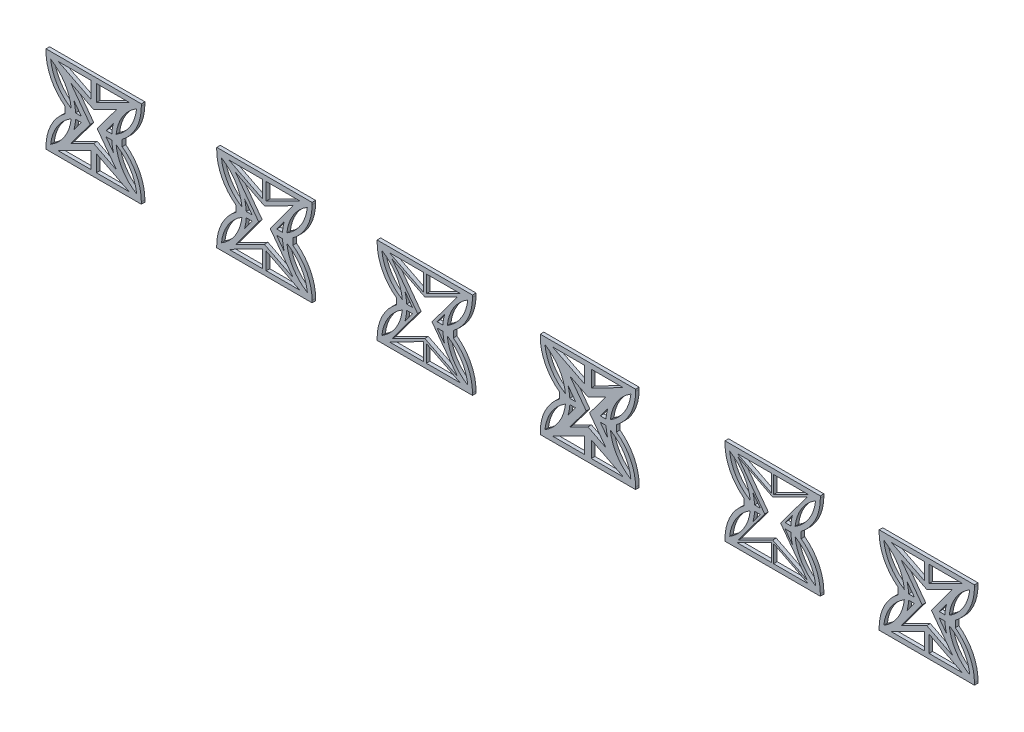
from build123d import *

# Parameters (mm, degrees)
BOSS_EXTRUDE1_DEPTH   = 1.2
BOSS_EXTRUDE1_2_DEPTH = 1.2
BOSS_EXTRUDE1_3_DEPTH = 1.2
BOSS_EXTRUDE1_4_DEPTH = 1.2
BOSS_EXTRUDE1_5_DEPTH = 1.2
BOSS_EXTRUDE1_6_DEPTH = 1.2


with BuildPart() as part:
    # Sketch1 → Boss-Extrude1 (new body)
    with BuildSketch(Plane.XY):
        with BuildLine():
            Line((-10.302018004, 3.271108001), (-10.302018004, 1.110990221))
            ThreePointArc((-10.302018004, 1.110990221), (-15.057769334, -4.572954896), (-16.763496129, -11.785090426))
            Line((-16.763496129, -11.785090426), (-16.763496129, -12.501542078))
            Line((-16.763496129, -12.501542078), (15.436503871, -12.501542078))
            Line((15.436503871, -12.501542078), (15.436503871, -11.785090426))
            ThreePointArc((15.436503871, -11.785090426), (13.730777076, -4.572954896), (8.975025747, 1.110990221))
            Line((8.975025747, 1.110990221), (8.975025747, 3.271108001))
            ThreePointArc((8.975025747, 3.271108001), (13.730777076, 8.955053118), (15.436503871, 16.167188648))
            Line((15.436503871, 16.167188648), (15.436503871, 16.883640301))
            Line((15.436503871, 16.883640301), (-16.763496129, 16.883640301))
            Line((-16.763496129, 16.883640301), (-16.763496129, 16.167188648))
            ThreePointArc((-16.763496129, 16.167188648), (-15.057769334, 8.955053118), (-10.302018004, 3.271108001))
        make_face()
        Polygon((-8.409623915, 11.04926607), (-1.851704299, 2.191049111), (-8.409623915, -6.667167848), (-0.663496129, -2.754877962), (7.082631657, -6.667167848), (0.524712041, 2.191049111), (7.082631657, 11.04926607), (-0.663496129, 7.136976185), align=None, mode=Mode.SUBTRACT)
        Polygon((-1.586935905, -10.866558404), (-12.627539219, -10.866558404), (-1.586935905, -5.290347699), (-1.586935905, -10.705031536), align=None, mode=Mode.SUBTRACT)
        with BuildLine():
            Line((-4.829630218, 3.109581133), (-6.778538045, 3.109581133))
            ThreePointArc((-6.778538045, 3.109581133), (-6.96992636, 4.823270811), (-7.344408998, 6.506459616))
            Line((-7.344408998, 6.506459616), (-4.829630218, 3.109581133))
        make_face(mode=Mode.SUBTRACT)
        Polygon((0.259943647, 15.087129758), (0.259943647, 15.248656627), (11.300546962, 15.248656627), (0.259943647, 9.672445922), align=None, mode=Mode.SUBTRACT)
        with BuildLine():
            Line((3.50263796, 3.109581133), (5.451545787, 3.109581133))
            ThreePointArc((5.451545787, 3.109581133), (5.642934102, 4.823270811), (6.01741674, 6.506459616))
            Line((6.01741674, 6.506459616), (3.50263796, 3.109581133))
        make_face(mode=Mode.SUBTRACT)
        Polygon((-1.586935905, 15.248656627), (-12.627539219, 15.248656627), (-1.586935905, 9.672445922), (-1.586935905, 15.087129758), align=None, mode=Mode.SUBTRACT)
        Polygon((0.259943647, -5.290347699), (0.259943647, -10.866558404), (11.300546962, -10.866558404), align=None, mode=Mode.SUBTRACT)
        with BuildLine():
            Line((-4.829630218, 1.27251709), (-6.778538045, 1.27251709))
            ThreePointArc((-6.778538045, 1.27251709), (-6.96992636, -0.441172588), (-7.344408998, -2.124361394))
            Line((-7.344408998, -2.124361394), (-4.829630218, 1.27251709))
        make_face(mode=Mode.SUBTRACT)
        with BuildLine():
            Line((3.50263796, 1.27251709), (5.451545787, 1.27251709))
            ThreePointArc((5.451545787, 1.27251709), (5.642934102, -0.441172588), (6.01741674, -2.124361394))
            Line((6.01741674, -2.124361394), (3.50263796, 1.27251709))
        make_face(mode=Mode.SUBTRACT)
        with BuildLine():
            ThreePointArc((13.849027666, 14.650245783), (9.110337743, 9.988254603), (6.931428547, 3.707991976))
            ThreePointArc((6.931428547, 3.707991976), (11.67011847, 8.369983156), (13.849027666, 14.650245783))
        make_face(mode=Mode.SUBTRACT)
        with BuildLine():
            ThreePointArc((-8.258420804, 3.707991976), (-12.997110727, 8.369983156), (-15.176019924, 14.650245783))
            ThreePointArc((-15.176019924, 14.650245783), (-10.43733, 9.988254603), (-8.258420804, 3.707991976))
        make_face(mode=Mode.SUBTRACT)
        with BuildLine():
            ThreePointArc((13.849027666, -10.268147561), (9.110337743, -5.606156381), (6.931428547, 0.674106247))
            ThreePointArc((6.931428547, 0.674106247), (11.67011847, -3.987884934), (13.849027666, -10.268147561))
        make_face(mode=Mode.SUBTRACT)
        with BuildLine():
            ThreePointArc((-8.258420804, 0.674106247), (-12.997110727, -3.987884934), (-15.176019924, -10.268147561))
            ThreePointArc((-15.176019924, -10.268147561), (-10.43733, -5.606156381), (-8.258420804, 0.674106247))
        make_face(mode=Mode.SUBTRACT)
    extrude(amount=BOSS_EXTRUDE1_DEPTH)


with BuildPart() as body_2:
    # Sketch1 → Boss-Extrude1 2 (new body)
    with BuildSketch(Plane.XY):
        with BuildLine():
            Line((40.905511172, -12.501542078), (73.105511172, -12.501542078))
            Line((73.105511172, -12.501542078), (73.105511172, -11.785090426))
            ThreePointArc((73.105511172, -11.785090426), (71.399784377, -4.572954896), (66.644033048, 1.110990221))
            Line((66.644033048, 1.110990221), (66.644033048, 3.271108001))
            ThreePointArc((66.644033048, 3.271108001), (71.399784377, 8.955053118), (73.105511172, 16.167188648))
            Line((73.105511172, 16.167188648), (73.105511172, 16.883640301))
            Line((73.105511172, 16.883640301), (40.905511172, 16.883640301))
            Line((40.905511172, 16.883640301), (40.905511172, 16.167188648))
            ThreePointArc((40.905511172, 16.167188648), (42.611237968, 8.955053118), (47.366989297, 3.271108001))
            Line((47.366989297, 3.271108001), (47.366989297, 1.110990221))
            ThreePointArc((47.366989297, 1.110990221), (42.611237968, -4.572954896), (40.905511172, -11.785090426))
            Line((40.905511172, -11.785090426), (40.905511172, -12.501542078))
        make_face()
        Polygon((56.382071397, 15.248656627), (45.041468082, 15.248656627), (56.382071397, 9.520926737), align=None, mode=Mode.SUBTRACT)
        with BuildLine():
            Line((52.839377084, 1.27251709), (50.324598303, -2.124361394))
            ThreePointArc((50.324598303, -2.124361394), (50.699080942, -0.441172588), (50.890469257, 1.27251709))
            Line((50.890469257, 1.27251709), (52.839377084, 1.27251709))
        make_face(mode=Mode.SUBTRACT)
        with BuildLine():
            Line((52.839377084, 3.109581133), (50.890469257, 3.109581133))
            ThreePointArc((50.890469257, 3.109581133), (50.699080942, 4.823270811), (50.324598303, 6.506459616))
            Line((50.324598303, 6.506459616), (52.839377084, 3.109581133))
        make_face(mode=Mode.SUBTRACT)
        with BuildLine():
            Line((61.171645261, 3.109581133), (63.686424042, 6.506459616))
            ThreePointArc((63.686424042, 6.506459616), (63.311941403, 4.823270811), (63.120553088, 3.109581133))
            Line((63.120553088, 3.109581133), (61.171645261, 3.109581133))
        make_face(mode=Mode.SUBTRACT)
        with BuildLine():
            Line((61.171645261, 1.27251709), (63.120553088, 1.27251709))
            ThreePointArc((63.120553088, 1.27251709), (63.311941403, -0.441172588), (63.686424042, -2.124361394))
            Line((63.686424042, -2.124361394), (61.171645261, 1.27251709))
        make_face(mode=Mode.SUBTRACT)
        Polygon((57.628950948, 9.520926737), (68.969554263, 15.248656627), (57.628950948, 15.248656627), align=None, mode=Mode.SUBTRACT)
        Polygon((66.738829847, 12.725109234), (58.940249181, 2.191049111), (66.738829847, -8.343011012), (57.005511172, -3.427062649), (47.272192498, -8.343011012), (55.070773164, 2.191049111), (47.272192498, 12.725109234), (57.005511172, 7.809160871), align=None, mode=Mode.SUBTRACT)
        Polygon((68.969554263, -10.866558404), (57.628950948, -10.866558404), (57.628950948, -5.138828515), align=None, mode=Mode.SUBTRACT)
        Polygon((56.382071397, -10.866558404), (56.382071397, -5.138828515), (45.041468082, -10.866558404), align=None, mode=Mode.SUBTRACT)
        with BuildLine():
            ThreePointArc((42.492987378, 14.650245783), (47.231677301, 9.988254603), (49.410586497, 3.707991976))
            ThreePointArc((49.410586497, 3.707991976), (44.671896574, 8.369983156), (42.492987378, 14.650245783))
        make_face(mode=Mode.SUBTRACT)
        with BuildLine():
            ThreePointArc((49.410586497, 0.674106247), (44.671896574, -3.987884934), (42.492987378, -10.268147561))
            ThreePointArc((42.492987378, -10.268147561), (47.231677301, -5.606156381), (49.410586497, 0.674106247))
        make_face(mode=Mode.SUBTRACT)
        with BuildLine():
            ThreePointArc((64.600435848, 0.674106247), (69.339125771, -3.987884934), (71.518034967, -10.268147561))
            ThreePointArc((71.518034967, -10.268147561), (66.779345044, -5.606156381), (64.600435848, 0.674106247))
        make_face(mode=Mode.SUBTRACT)
        with BuildLine():
            ThreePointArc((71.518034967, 14.650245783), (66.779345044, 9.988254603), (64.600435848, 3.707991976))
            ThreePointArc((64.600435848, 3.707991976), (69.339125771, 8.369983156), (71.518034967, 14.650245783))
        make_face(mode=Mode.SUBTRACT)
    extrude(amount=BOSS_EXTRUDE1_2_DEPTH)


with BuildPart() as body_3:
    # Sketch1 → Boss-Extrude1 3 (new body)
    with BuildSketch(Plane.XY):
        with BuildLine():
            Line((95.090603796, -11.785090426), (95.090603796, -12.501542078))
            Line((95.090603796, -12.501542078), (127.290603796, -12.501542078))
            Line((127.290603796, -12.501542078), (127.290603796, -11.785090426))
            ThreePointArc((127.290603796, -11.785090426), (125.584877001, -4.572954896), (120.829125672, 1.110990221))
            Line((120.829125672, 1.110990221), (120.829125672, 3.271108001))
            ThreePointArc((120.829125672, 3.271108001), (125.584877001, 8.955053118), (127.290603796, 16.167188648))
            Line((127.290603796, 16.167188648), (127.290603796, 16.883640301))
            Line((127.290603796, 16.883640301), (95.090603796, 16.883640301))
            Line((95.090603796, 16.883640301), (95.090603796, 16.167188648))
            ThreePointArc((95.090603796, 16.167188648), (96.796330592, 8.955053118), (101.552081921, 3.271108001))
            Line((101.552081921, 3.271108001), (101.552081921, 1.110990221))
            ThreePointArc((101.552081921, 1.110990221), (96.796330592, -4.572954896), (95.090603796, -11.785090426))
        make_face()
        Polygon((111.690603792, 9.458581754), (123.154646887, 15.248656627), (111.690603792, 15.248656627), align=None, mode=Mode.SUBTRACT)
        with BuildLine():
            Line((115.356737885, 3.109581133), (117.305645712, 3.109581133))
            ThreePointArc((117.305645712, 3.109581133), (117.497034027, 4.823270811), (117.871516666, 6.506459616))
            Line((117.871516666, 6.506459616), (115.356737885, 3.109581133))
        make_face(mode=Mode.SUBTRACT)
        Polygon((110.690603801, 9.458581754), (99.226560706, 15.248656627), (110.690603801, 15.248656627), align=None, mode=Mode.SUBTRACT)
        with BuildLine():
            Line((107.024469708, 1.27251709), (104.509690927, -2.124361394))
            ThreePointArc((104.509690927, -2.124361394), (104.884173566, -0.441172588), (105.075561881, 1.27251709))
            Line((105.075561881, 1.27251709), (107.024469708, 1.27251709))
        make_face(mode=Mode.SUBTRACT)
        with BuildLine():
            Line((115.356737885, 1.27251709), (117.305645712, 1.27251709))
            ThreePointArc((117.305645712, 1.27251709), (117.497034027, -0.441172588), (117.871516666, -2.124361394))
            Line((117.871516666, -2.124361394), (115.356737885, 1.27251709))
        make_face(mode=Mode.SUBTRACT)
        with BuildLine():
            Line((107.024469708, 3.109581133), (104.509690927, 6.506459616))
            ThreePointArc((104.509690927, 6.506459616), (104.884173566, 4.823270811), (105.075561881, 3.109581133))
            Line((105.075561881, 3.109581133), (107.024469708, 3.109581133))
        make_face(mode=Mode.SUBTRACT)
        Polygon((122.248716397, 13.84233801), (113.623028364, 2.191049111), (122.248716397, -9.460239788), (111.190603796, -3.875185774), (100.132491196, -9.460239788), (108.758179229, 2.191049111), (100.132491196, 13.84233801), (111.190603796, 8.257283996), align=None, mode=Mode.SUBTRACT)
        Polygon((111.690603792, -5.076483532), (123.154646887, -10.866558404), (111.690603792, -10.866558404), align=None, mode=Mode.SUBTRACT)
        Polygon((110.690603801, -10.866558404), (110.690603801, -5.076483532), (99.226560706, -10.866558404), align=None, mode=Mode.SUBTRACT)
        with BuildLine():
            ThreePointArc((125.703127591, 14.650245783), (120.964437668, 9.988254603), (118.785528472, 3.707991976))
            ThreePointArc((118.785528472, 3.707991976), (123.524218395, 8.369983156), (125.703127591, 14.650245783))
        make_face(mode=Mode.SUBTRACT)
        with BuildLine():
            ThreePointArc((118.785528472, 0.674106247), (123.524218395, -3.987884934), (125.703127591, -10.268147561))
            ThreePointArc((125.703127591, -10.268147561), (120.964437668, -5.606156381), (118.785528472, 0.674106247))
        make_face(mode=Mode.SUBTRACT)
        with BuildLine():
            ThreePointArc((96.678080002, 14.650245783), (101.416769925, 9.988254603), (103.595679121, 3.707991976))
            ThreePointArc((103.595679121, 3.707991976), (98.856989198, 8.369983156), (96.678080002, 14.650245783))
        make_face(mode=Mode.SUBTRACT)
        with BuildLine():
            ThreePointArc((103.595679121, 0.674106247), (98.856989198, -3.987884934), (96.678080002, -10.268147561))
            ThreePointArc((96.678080002, -10.268147561), (101.416769925, -5.606156381), (103.595679121, 0.674106247))
        make_face(mode=Mode.SUBTRACT)
    extrude(amount=BOSS_EXTRUDE1_3_DEPTH)


with BuildPart() as body_4:
    # Sketch1 → Boss-Extrude1 4 (new body)
    with BuildSketch(Plane.XY):
        with BuildLine():
            Line((212.590717444, 16.167188648), (212.590717444, 16.883640301))
            Line((212.590717444, 16.883640301), (244.790717444, 16.883640301))
            Line((244.790717444, 16.883640301), (244.790717444, 16.167188648))
            ThreePointArc((244.790717444, 16.167188648), (243.084990649, 8.955053118), (238.32923932, 3.271108001))
            Line((238.32923932, 3.271108001), (238.32923932, 1.110990221))
            ThreePointArc((238.32923932, 1.110990221), (243.084990649, -4.572954896), (244.790717444, -11.785090426))
            Line((244.790717444, -11.785090426), (244.790717444, -12.501542078))
            Line((244.790717444, -12.501542078), (212.590717444, -12.501542078))
            Line((212.590717444, -12.501542078), (212.590717444, -11.785090426))
            ThreePointArc((212.590717444, -11.785090426), (214.296444239, -4.572954896), (219.052195569, 1.110990221))
            Line((219.052195569, 1.110990221), (219.052195569, 3.271108001))
            ThreePointArc((219.052195569, 3.271108001), (214.296444239, 8.955053118), (212.590717444, 16.167188648))
        make_face()
        with BuildLine():
            Line((232.856851533, 1.27251709), (234.80575936, 1.27251709))
            ThreePointArc((234.80575936, 1.27251709), (234.997147675, -0.441172588), (235.371630313, -2.124361394))
            Line((235.371630313, -2.124361394), (232.856851533, 1.27251709))
        make_face(mode=Mode.SUBTRACT)
        with BuildLine():
            Line((224.524583355, 1.27251709), (222.575675528, 1.27251709))
            ThreePointArc((222.575675528, 1.27251709), (222.384287213, -0.441172588), (222.009804575, -2.124361394))
            Line((222.009804575, -2.124361394), (224.524583355, 1.27251709))
        make_face(mode=Mode.SUBTRACT)
        with BuildLine():
            Line((224.524583355, 3.109581133), (222.009804575, 6.506459616))
            ThreePointArc((222.009804575, 6.506459616), (222.384287213, 4.823270811), (222.575675528, 3.109581133))
            Line((222.575675528, 3.109581133), (224.524583355, 3.109581133))
        make_face(mode=Mode.SUBTRACT)
        Polygon((240.654760535, 15.248656627), (229.01415722, 15.248656627), (229.01415722, 9.369407553), align=None, mode=Mode.SUBTRACT)
        with BuildLine():
            Line((232.856851533, 3.109581133), (235.371630313, 6.506459616))
            ThreePointArc((235.371630313, 6.506459616), (234.997147675, 4.823270811), (234.80575936, 3.109581133))
            Line((234.80575936, 3.109581133), (232.856851533, 3.109581133))
        make_face(mode=Mode.SUBTRACT)
        Polygon((228.367277668, 9.369407553), (216.726674354, 15.248656627), (228.367277668, 15.248656627), align=None, mode=Mode.SUBTRACT)
        Polygon((228.690717444, -4.099247336), (240.411227008, -10.018854175), (231.371985291, 2.191049111), (240.411227008, 14.400952398), (228.690717444, 8.481345558), (216.970207881, 14.400952398), (226.009449597, 2.191049111), (216.970207881, -10.018854175), align=None, mode=Mode.SUBTRACT)
        Polygon((229.01415722, -4.98730933), (240.654760535, -10.866558404), (229.01415722, -10.866558404), align=None, mode=Mode.SUBTRACT)
        Polygon((228.367277668, -10.866558404), (228.367277668, -4.98730933), (216.726674354, -10.866558404), align=None, mode=Mode.SUBTRACT)
        with BuildLine():
            ThreePointArc((236.28564212, 0.674106247), (241.024332043, -3.987884934), (243.203241239, -10.268147561))
            ThreePointArc((243.203241239, -10.268147561), (238.464551316, -5.606156381), (236.28564212, 0.674106247))
        make_face(mode=Mode.SUBTRACT)
        with BuildLine():
            ThreePointArc((214.178193649, -10.268147561), (218.916883572, -5.606156381), (221.095792769, 0.674106247))
            ThreePointArc((221.095792769, 0.674106247), (216.357102846, -3.987884934), (214.178193649, -10.268147561))
        make_face(mode=Mode.SUBTRACT)
        with BuildLine():
            ThreePointArc((236.28564212, 3.707991976), (241.024332043, 8.369983156), (243.203241239, 14.650245783))
            ThreePointArc((243.203241239, 14.650245783), (238.464551316, 9.988254603), (236.28564212, 3.707991976))
        make_face(mode=Mode.SUBTRACT)
        with BuildLine():
            ThreePointArc((214.178193649, 14.650245783), (218.916883572, 9.988254603), (221.095792769, 3.707991976))
            ThreePointArc((221.095792769, 3.707991976), (216.357102846, 8.369983156), (214.178193649, 14.650245783))
        make_face(mode=Mode.SUBTRACT)
    extrude(amount=BOSS_EXTRUDE1_4_DEPTH)


with BuildPart() as body_5:
    # Sketch1 → Boss-Extrude1 5 (new body)
    with BuildSketch(Plane.XY):
        with BuildLine():
            Line((150.188573323, 16.167188648), (150.188573323, 16.883640301))
            Line((150.188573323, 16.883640301), (182.388573323, 16.883640301))
            Line((182.388573323, 16.883640301), (182.388573323, 16.167188648))
            ThreePointArc((182.388573323, 16.167188648), (180.682846528, 8.955053118), (175.927095198, 3.271108001))
            Line((175.927095198, 3.271108001), (175.927095198, 1.110990221))
            ThreePointArc((175.927095198, 1.110990221), (180.682846528, -4.572954896), (182.388573323, -11.785090426))
            Line((182.388573323, -11.785090426), (182.388573323, -12.501542078))
            Line((182.388573323, -12.501542078), (150.188573323, -12.501542078))
            Line((150.188573323, -12.501542078), (150.188573323, -11.785090426))
            ThreePointArc((150.188573323, -11.785090426), (151.894300118, -4.572954896), (156.650051447, 1.110990221))
            Line((156.650051447, 1.110990221), (156.650051447, 3.271108001))
            ThreePointArc((156.650051447, 3.271108001), (151.894300118, 8.955053118), (150.188573323, 16.167188648))
        make_face()
        with BuildLine():
            Line((170.454707412, 1.27251709), (172.403615239, 1.27251709))
            ThreePointArc((172.403615239, 1.27251709), (172.595003554, -0.441172588), (172.969486192, -2.124361394))
            Line((172.969486192, -2.124361394), (170.454707412, 1.27251709))
        make_face(mode=Mode.SUBTRACT)
        with BuildLine():
            Line((162.122439234, 1.27251709), (160.173531407, 1.27251709))
            ThreePointArc((160.173531407, 1.27251709), (159.982143092, -0.441172588), (159.607660454, -2.124361394))
            Line((159.607660454, -2.124361394), (162.122439234, 1.27251709))
        make_face(mode=Mode.SUBTRACT)
        with BuildLine():
            Line((162.122439234, 3.109581133), (159.607660454, 6.506459616))
            ThreePointArc((159.607660454, 6.506459616), (159.982143092, 4.823270811), (160.173531407, 3.109581133))
            Line((160.173531407, 3.109581133), (162.122439234, 3.109581133))
        make_face(mode=Mode.SUBTRACT)
        Polygon((178.252616413, 15.248656627), (167.462013103, 15.248656627), (167.462013103, 9.798711911), align=None, mode=Mode.SUBTRACT)
        with BuildLine():
            Line((170.454707412, 3.109581133), (172.969486192, 6.506459616))
            ThreePointArc((172.969486192, 6.506459616), (172.595003554, 4.823270811), (172.403615239, 3.109581133))
            Line((172.403615239, 3.109581133), (170.454707412, 3.109581133))
        make_face(mode=Mode.SUBTRACT)
        Polygon((165.115133543, 9.798711911), (154.324530232, 15.248656627), (165.115133543, 15.248656627), align=None, mode=Mode.SUBTRACT)
        Polygon((166.288573323, -2.194724057), (172.378708701, -5.270631878), (166.854673294, 2.191049111), (172.378708701, 9.6527301), (166.288573323, 6.576822279), (160.198437944, 9.6527301), (165.722473352, 2.191049111), (160.198437944, -5.270631878), align=None, mode=Mode.SUBTRACT)
        Polygon((167.462013103, -10.866558404), (167.462013103, -5.416613689), (178.252616413, -10.866558404), align=None, mode=Mode.SUBTRACT)
        Polygon((165.115133543, -10.866558404), (165.115133543, -5.416613689), (154.324530232, -10.866558404), align=None, mode=Mode.SUBTRACT)
        with BuildLine():
            ThreePointArc((173.883497998, 0.674106247), (178.622187921, -3.987884934), (180.801097118, -10.268147561))
            ThreePointArc((180.801097118, -10.268147561), (176.062407195, -5.606156381), (173.883497998, 0.674106247))
        make_face(mode=Mode.SUBTRACT)
        with BuildLine():
            ThreePointArc((151.776049528, -10.268147561), (156.514739451, -5.606156381), (158.693648647, 0.674106247))
            ThreePointArc((158.693648647, 0.674106247), (153.954958724, -3.987884934), (151.776049528, -10.268147561))
        make_face(mode=Mode.SUBTRACT)
        with BuildLine():
            ThreePointArc((173.883497998, 3.707991976), (178.622187921, 8.369983156), (180.801097118, 14.650245783))
            ThreePointArc((180.801097118, 14.650245783), (176.062407195, 9.988254603), (173.883497998, 3.707991976))
        make_face(mode=Mode.SUBTRACT)
        with BuildLine():
            ThreePointArc((151.776049528, 14.650245783), (156.514739451, 9.988254603), (158.693648647, 3.707991976))
            ThreePointArc((158.693648647, 3.707991976), (153.954958724, 8.369983156), (151.776049528, 14.650245783))
        make_face(mode=Mode.SUBTRACT)
    extrude(amount=BOSS_EXTRUDE1_5_DEPTH)


with BuildPart() as body_6:
    # Sketch1 → Boss-Extrude1 6 (new body)
    with BuildSketch(Plane.XY):
        with BuildLine():
            Line((264.653961576, 16.167188648), (264.653961576, 16.883640301))
            Line((264.653961576, 16.883640301), (296.853961576, 16.883640301))
            Line((296.853961576, 16.883640301), (296.853961576, 16.167188648))
            ThreePointArc((296.853961576, 16.167188648), (295.148234781, 8.955053118), (290.392483451, 3.271108001))
            Line((290.392483451, 3.271108001), (290.392483451, 1.110990221))
            ThreePointArc((290.392483451, 1.110990221), (295.148234781, -4.572954896), (296.853961576, -11.785090426))
            Line((296.853961576, -11.785090426), (296.853961576, -12.501542078))
            Line((296.853961576, -12.501542078), (264.653961576, -12.501542078))
            Line((264.653961576, -12.501542078), (264.653961576, -11.785090426))
            ThreePointArc((264.653961576, -11.785090426), (266.359688371, -4.572954896), (271.1154397, 1.110990221))
            Line((271.1154397, 1.110990221), (271.1154397, 3.271108001))
            ThreePointArc((271.1154397, 3.271108001), (266.359688371, 8.955053118), (264.653961576, 16.167188648))
        make_face()
        with BuildLine():
            Line((284.920095665, 1.27251709), (286.869003491, 1.27251709))
            ThreePointArc((286.869003491, 1.27251709), (287.060391806, -0.441172588), (287.434874445, -2.124361394))
            Line((287.434874445, -2.124361394), (284.920095665, 1.27251709))
        make_face(mode=Mode.SUBTRACT)
        with BuildLine():
            Line((276.587827487, 1.27251709), (274.63891966, 1.27251709))
            ThreePointArc((274.63891966, 1.27251709), (274.447531345, -0.441172588), (274.073048706, -2.124361394))
            Line((274.073048706, -2.124361394), (276.587827487, 1.27251709))
        make_face(mode=Mode.SUBTRACT)
        with BuildLine():
            Line((276.587827487, 3.109581133), (274.073048706, 6.506459616))
            ThreePointArc((274.073048706, 6.506459616), (274.447531345, 4.823270811), (274.63891966, 3.109581133))
            Line((274.63891966, 3.109581133), (276.587827487, 3.109581133))
        make_face(mode=Mode.SUBTRACT)
        Polygon((292.718004666, 15.248656627), (281.527401351, 15.248656627), (281.527401351, 9.596686329), align=None, mode=Mode.SUBTRACT)
        with BuildLine():
            Line((284.920095665, 3.109581133), (287.434874445, 6.506459616))
            ThreePointArc((287.434874445, 6.506459616), (287.060391806, 4.823270811), (286.869003491, 3.109581133))
            Line((286.869003491, 3.109581133), (284.920095665, 3.109581133))
        make_face(mode=Mode.SUBTRACT)
        Polygon((279.9805218, 9.596686329), (268.789918485, 15.248656627), (279.9805218, 15.248656627), align=None, mode=Mode.SUBTRACT)
        Polygon((280.753961576, 7.473068528), (289.493684806, 11.887187652), (282.315434665, 2.191049111), (289.493684806, -7.50508943), (280.753961576, -3.090970306), (272.014238345, -7.50508943), (279.192488486, 2.191049111), (272.014238345, 11.887187652), align=None, mode=Mode.SUBTRACT)
        Polygon((281.527401351, -5.214588107), (292.718004666, -10.866558404), (281.527401351, -10.866558404), align=None, mode=Mode.SUBTRACT)
        Polygon((279.9805218, -10.866558404), (279.9805218, -5.214588107), (268.789918485, -10.866558404), align=None, mode=Mode.SUBTRACT)
        with BuildLine():
            ThreePointArc((266.241437781, -10.268147561), (270.980127704, -5.606156381), (273.1590369, 0.674106247))
            ThreePointArc((273.1590369, 0.674106247), (268.420346977, -3.987884934), (266.241437781, -10.268147561))
        make_face(mode=Mode.SUBTRACT)
        with BuildLine():
            ThreePointArc((288.348886251, 3.707991976), (293.087576174, 8.369983156), (295.26648537, 14.650245783))
            ThreePointArc((295.26648537, 14.650245783), (290.527795447, 9.988254603), (288.348886251, 3.707991976))
        make_face(mode=Mode.SUBTRACT)
        with BuildLine():
            ThreePointArc((266.241437781, 14.650245783), (270.980127704, 9.988254603), (273.1590369, 3.707991976))
            ThreePointArc((273.1590369, 3.707991976), (268.420346977, 8.369983156), (266.241437781, 14.650245783))
        make_face(mode=Mode.SUBTRACT)
        with BuildLine():
            ThreePointArc((295.26648537, -10.268147561), (290.527795447, -5.606156381), (288.348886251, 0.674106247))
            ThreePointArc((288.348886251, 0.674106247), (293.087576174, -3.987884934), (295.26648537, -10.268147561))
        make_face(mode=Mode.SUBTRACT)
    extrude(amount=BOSS_EXTRUDE1_6_DEPTH)


solid = Compound([part.part, body_2.part, body_3.part, body_4.part, body_5.part, body_6.part])
